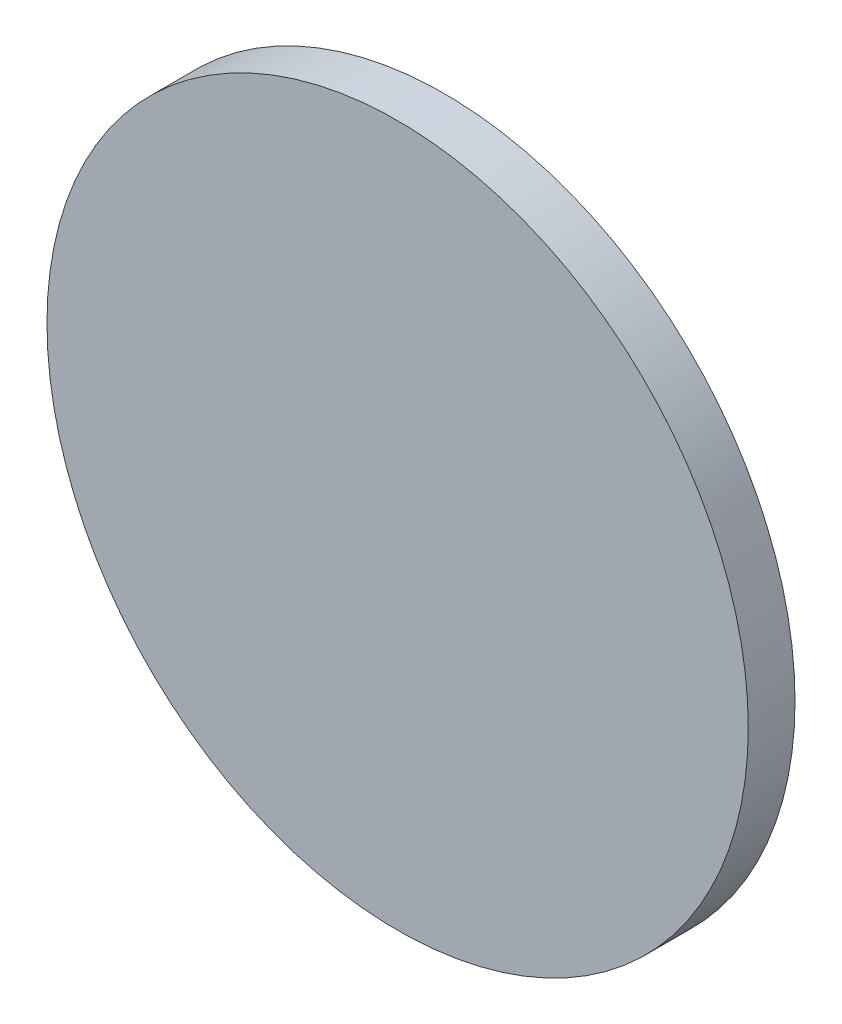
from build123d import *

# Parameters (mm, degrees)
SKETCH_1_R      = 15
EXTRUDE_1_DEPTH = 2


with BuildPart() as part:
    # Эскиз1 → Вытянуть1 (new body)
    with BuildSketch(Plane.XY):
        Circle(SKETCH_1_R)
    extrude(amount=EXTRUDE_1_DEPTH)


solid = part.part
